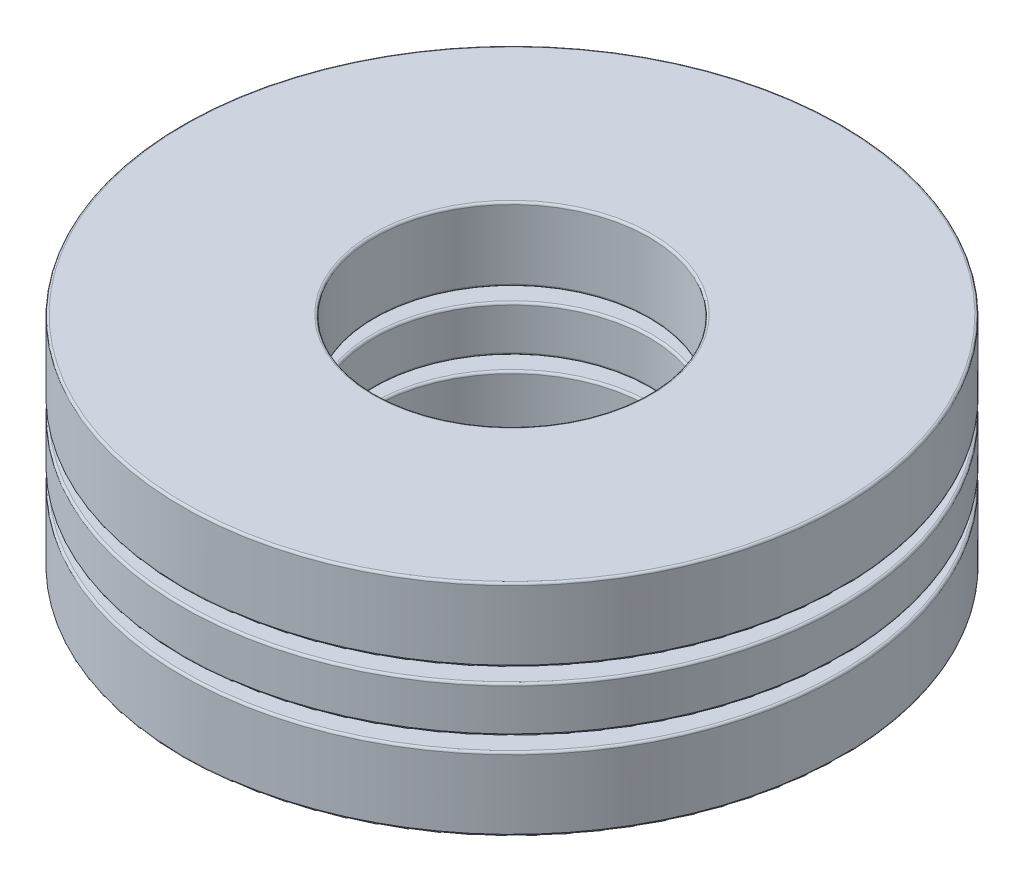
from build123d import *

# Parameters (mm, degrees)
SKETCH1_W         = 3.5
SKETCH1_H         = 0.833333334
CIRPATTERN1_COUNT = 3
CIRPATTERN1_ANGLE = 240
CIRPATTERN2_COUNT = 3
SKETCH4_W         = 3.5
SKETCH4_H         = 1.333333333
FILLET1_R         = 0.04
FILLET2_R         = 0.04
FILLET3_R         = 0.04


with BuildPart() as part:
    # Sketch1 → Revolve1 (revolve)
    with BuildSketch(Plane(origin=(0, 0, 0), x_dir=(0, 0, -1), z_dir=(1, 0, 0)), mode=Mode.PRIVATE) as revolve1_sk:
        with Locations((-4.25, 0)):
            Rectangle(SKETCH1_W, SKETCH1_H)
    revolve(revolve1_sk.sketch.rotate(Axis((0, -2, 0), (0, 1, 0)), 180), axis=Axis((0, -2, 0), (0, 1, 0)))

    # Sketch3 → Cut-Revolve1 (revolve, cut)
    with BuildSketch(Plane(origin=(0, 0, 0), x_dir=(0, 0, -1), z_dir=(1, 0, 0))):
        with BuildLine():
            Line((-4.25, 0.666666667), (-4.25, -0.666666667))
            ThreePointArc((-4.25, -0.666666667), (-4.916666667, 0), (-4.25, 0.666666667))
        make_face()
    cut_revolve1 = revolve(axis=Axis((0, 0.666666667, 4.25), (0, -1, 0)), mode=Mode.SUBTRACT)

    # CirPattern2: Cut-Revolve1 ×3 about axis
    cirpattern2_axis = Axis((0, 0, 0), (0, 1, 0))
    for i in range(1, CIRPATTERN2_COUNT):
        add(cut_revolve1.rotate(cirpattern2_axis, i * 360 / CIRPATTERN2_COUNT), mode=Mode.SUBTRACT)

    # Fillet2
    fillet2_edges = [part.edges().sort_by_distance(p)[0] for p in [
        (0, 0.416666667, 6),
        (0, 0.416666667, 2.5),
        (0, -0.416666667, 2.5),
        (0, -0.416666667, 6),
    ]]
    fillet(fillet2_edges, radius=FILLET2_R)


with BuildPart() as body_2:
    # Sketch2 → Revolve2 (revolve)
    with BuildSketch(Plane(origin=(0, 0, 0), x_dir=(0, 0, -1), z_dir=(1, 0, 0))):
        with BuildLine():
            Line((-4.25, 0.666666667), (-4.25, -0.666666667))
            ThreePointArc((-4.25, -0.666666667), (-4.916666667, 0), (-4.25, 0.666666667))
        make_face()
    revolve(axis=Axis((0, 0.666666667, 4.25), (0, -1, 0)))


with BuildPart() as cirpattern1_1:
    # CirPattern1: pattern copy
    add(body_2.part.rotate(Axis((0, 2, 0), (0, -1, 0)), 1 * CIRPATTERN1_ANGLE / (CIRPATTERN1_COUNT - 1)))


with BuildPart() as cirpattern1_2:
    # CirPattern1: pattern copy
    add(body_2.part.rotate(Axis((0, 2, 0), (0, -1, 0)), 2 * CIRPATTERN1_ANGLE / (CIRPATTERN1_COUNT - 1)))


with BuildPart() as body_5:
    # Sketch4 → Revolve3 (revolve)
    with BuildSketch(Plane(origin=(0, 0, 0), x_dir=(0, 0, -1), z_dir=(1, 0, 0)), mode=Mode.PRIVATE) as revolve3_sk:
        with Locations((-4.25, 1.333333333)):
            Rectangle(SKETCH4_W, SKETCH4_H)
        with Locations((-4.25, -1.333333333)):
            Rectangle(SKETCH4_W, SKETCH4_H)
    revolve(revolve3_sk.sketch.rotate(Axis((0, -2, 0), (0, 1, 0)), 180), axis=Axis((0, -2, 0), (0, 1, 0)))

    # Fillet1
    fillet1_edges = [body_5.edges().sort_by_distance(p)[0] for p in [
        (0, 0.666666667, 6),
        (0, 0.666666667, 2.5),
        (0, 2, 2.5),
        (0, 2, 6),
    ]]
    fillet(fillet1_edges, radius=FILLET1_R)

    # Fillet3
    fillet3_edges = [body_5.edges().sort_by_distance(p)[0] for p in [
        (0, -2, 6),
        (0, -2, 2.5),
        (0, -0.666666667, 2.5),
        (0, -0.666666667, 6),
    ]]
    fillet(fillet3_edges, radius=FILLET3_R)


solid = Compound([part.part, body_2.part, cirpattern1_1.part, cirpattern1_2.part, body_5.part])
